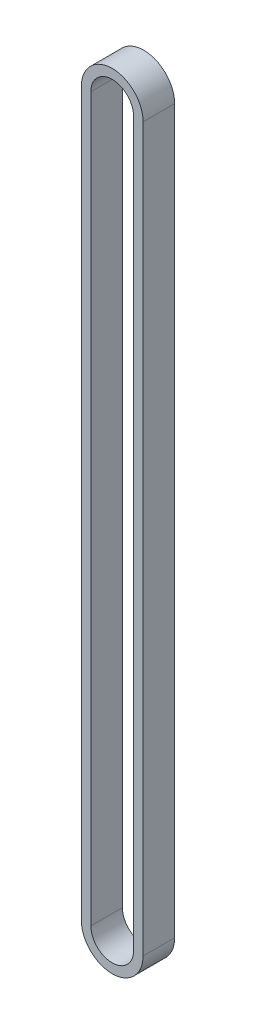
from build123d import *

# Parameters (mm, degrees)
EXTRUDE_1_DEPTH = 10


with BuildPart() as part:
    # 草图1 → 凸台-拉伸1 (new body)
    with BuildSketch(Plane.XY):
        with BuildLine():
            Line((-9.78, -114.5), (-9.78, 114.5))
            ThreePointArc((-9.78, 114.5), (0, 124.28), (9.78, 114.5))
            Line((9.78, 114.5), (9.78, -114.5))
            ThreePointArc((9.78, -114.5), (0, -124.28), (-9.78, -114.5))
        make_face()
        with BuildLine():
            Line((-6.78, -114.5), (-6.78, 114.5))
            ThreePointArc((-6.78, 114.5), (0, 121.28), (6.78, 114.5))
            Line((6.78, 114.5), (6.78, -114.5))
            ThreePointArc((6.78, -114.5), (0, -121.28), (-6.78, -114.5))
        make_face(mode=Mode.SUBTRACT)
    extrude(amount=EXTRUDE_1_DEPTH)


solid = part.part
